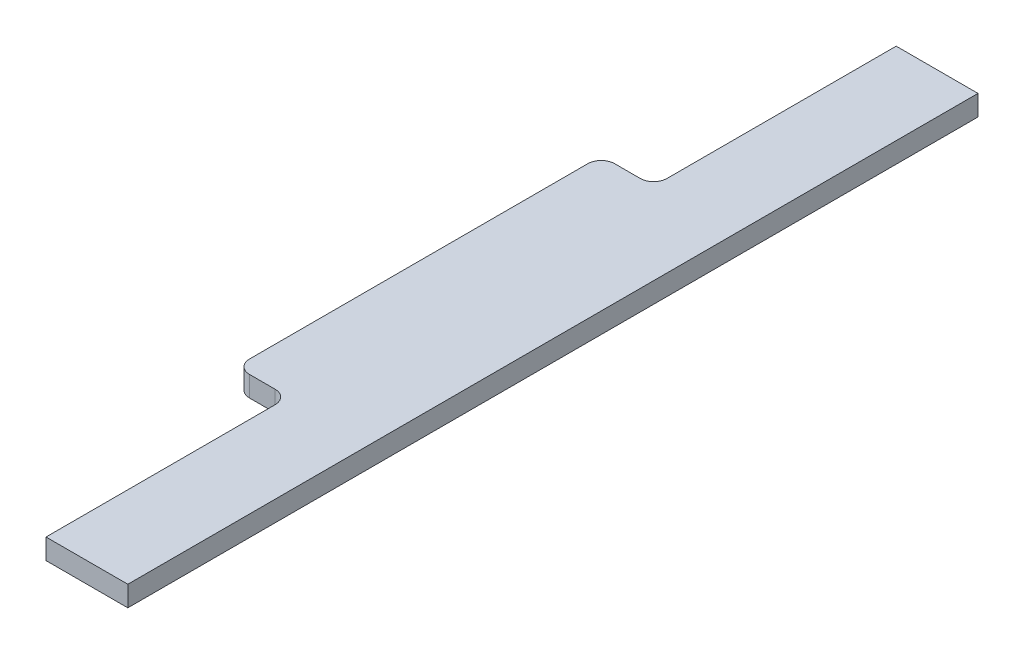
from build123d import *

# Parameters (mm, degrees)
BOSS_EXTRUDE1_DEPTH = 38.1


with BuildPart() as part:
    # Sketch1 → Boss-Extrude1 (new body)
    with BuildSketch(Plane(origin=(0, 0, 0), x_dir=(1, 0, 0), z_dir=(0, 1, 0))):
        with BuildLine():
            Line((0, 1156.75), (0, 1583.5))
            Line((0, 1583.5), (152.4, 1583.5))
            Line((152.4, 1583.5), (152.4, 0))
            Line((152.4, 0), (0, 0))
            Line((0, 0), (0, 426.75))
            ThreePointArc((0, 426.75), (-7.32233047, 444.42766953), (-25, 451.75))
            Line((-25, 451.75), (-72.6, 451.75))
            ThreePointArc((-72.6, 451.75), (-90.27766953, 459.07233047), (-97.6, 476.75))
            Line((-97.6, 476.75), (-97.6, 1106.75))
            ThreePointArc((-97.6, 1106.75), (-90.27766953, 1124.42766953), (-72.6, 1131.75))
            Line((-72.6, 1131.75), (-25, 1131.75))
            ThreePointArc((-25, 1131.75), (-7.32233047, 1139.07233047), (0, 1156.75))
        make_face()
    extrude(amount=BOSS_EXTRUDE1_DEPTH)


solid = part.part
